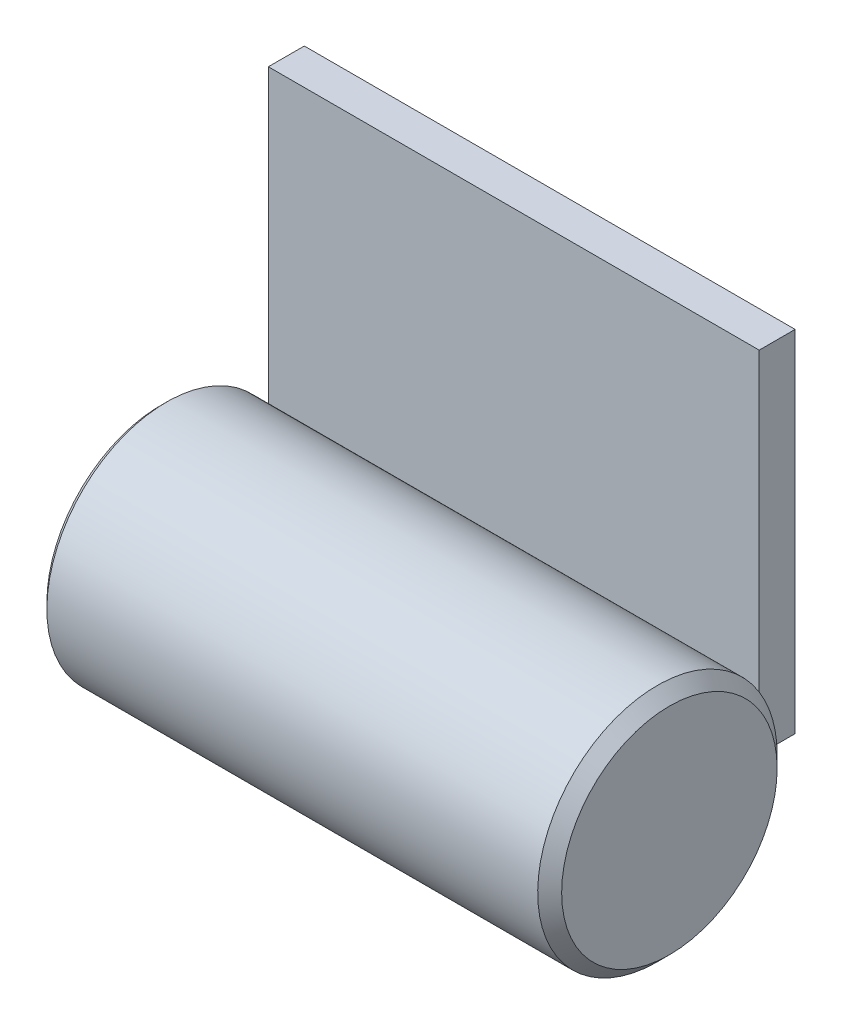
from build123d import *

# Parameters (mm, degrees)
SKETCH_2_W          = 82
SKETCH_2_H          = 6.001237201
EXTRUDE_1_DEPTH     = 60
SKETCH_3_W          = 82
SKETCH_3_H          = 3.004928021
CUT_EXTRUDE_1_DEPTH = 1.5


with BuildPart() as part:
    # Эскиз1 → Повернуть4 (revolve)
    with BuildSketch(Plane(origin=(0, 0, 0), x_dir=(1, 0, 0), z_dir=(0, 1, 0))):
        Polygon((92.65287472, 0), (92.65287472, 18), (90.65287472, 20), (8.65287472, 20), (7.65287472, 19), (7.65287472, 14.750046626), (8.65287472, 13.750046626), (71.629429714, 13.750046626), (71.629429714, 3.430205497), (76.798526349, 0), align=None)
    revolve(axis=Axis((102.994030824, 0, 0), (-1, 0, 0)))

    # Эскиз2 → Бобышка-Вытянуть1 (add)
    with BuildSketch(Plane(origin=(0, 0, 0), x_dir=(1, 0, 0), z_dir=(0, 1, 0))):
        with Locations((49.65287472, 20.004309421)):
            Rectangle(SKETCH_2_W, SKETCH_2_H)
    extrude(amount=EXTRUDE_1_DEPTH)

    # Эскиз3 → Вырез-Вытянуть1 (cut)
    with BuildSketch(Plane.XZ):
        with Locations((49.65287472, -21.50246401)):
            Rectangle(SKETCH_3_W, SKETCH_3_H)
    extrude(amount=-CUT_EXTRUDE_1_DEPTH, mode=Mode.SUBTRACT)


solid = part.part
